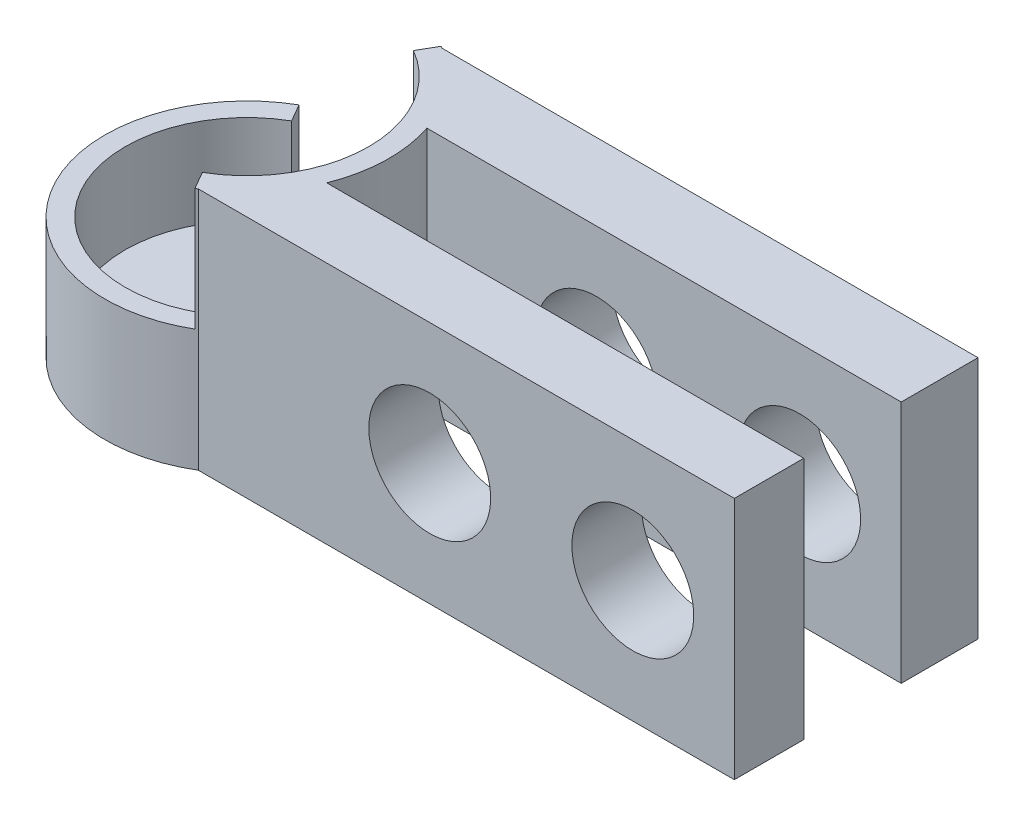
from build123d import *

# Parameters (mm, degrees)
BOSS_EXTRUDE1_DEPTH     = 30
CUT_EXTRUDE1_START      = 4
CUT_EXTRUDE1_DEPTH      = 30
SKETCH3_R               = 2
CUT_EXTRUDE2_DEPTH      = 9.5
CUT_EXTRUDE3_START      = 15
CUT_EXTRUDE3_DEPTH      = 20
CUT_EXTRUDE4_DEPTH      = 20
CUT_EXTRUDE4_DEPTH_BACK = 20
SKETCH5_R               = 7.5


with BuildPart() as part:
    # Sketch1 → Boss-Extrude1 (new body)
    with BuildSketch(Plane(origin=(0, 0, 0), x_dir=(1, 0, 0), z_dir=(0, 1, 0))):
        with BuildLine():
            Line((9.013878189, 15), (75, 15))
            Line((75, 15), (75, 5.549099401))
            Line((75, 5.549099401), (16.596912238, 5.549099401))
            ThreePointArc((16.596912238, 5.549099401), (17.493415402, -0.480018296), (16.26763294, -6.450900599))
            Line((16.26763294, -6.450900599), (75, -6.450900599))
            Line((75, -6.450900599), (75, -15))
            Line((75, -15), (9.013878189, -15))
            ThreePointArc((9.013878189, -15), (-17.5, 0), (9.013878189, 15))
        make_face()
    extrude(amount=BOSS_EXTRUDE1_DEPTH)

    # Sketch2 → Cut-Extrude1 (cut)
    with BuildSketch(Plane(origin=(0, 0, 0), x_dir=(1, 0, 0), z_dir=(0, 1, 0)).offset(CUT_EXTRUDE1_START)):
        with BuildLine():
            Line((8.75, 15.155444566), (7.5, 12.990381057))
            ThreePointArc((7.5, 12.990381057), (0, -15), (-7.5, 12.990381057))
            Line((-7.5, 12.990381057), (-8.75, 15.155444566))
            ThreePointArc((-8.75, 15.155444566), (-4.529333289, 16.90370196), (0, 17.5))
            ThreePointArc((0, 17.5), (4.529333289, 16.90370196), (8.75, 15.155444566))
        make_face()
    extrude(amount=CUT_EXTRUDE1_DEPTH, mode=Mode.SUBTRACT)

    # Sketch3 → Cut-Extrude2 (cut)
    with BuildSketch(Plane(origin=(0, 0, 0), x_dir=(1, 0, 0), z_dir=(0, 1, 0))):
        with Locations(Location((6.717514421, 6.717514421, 0), (0, 0, 270))):
            Circle(SKETCH3_R)
        with Locations(Location((6.717514421, -6.717514421, 0), (0, 0, 270))):
            Circle(SKETCH3_R)
        with Locations(Location((-6.717514421, -6.717514421, 0), (0, 0, 270))):
            Circle(SKETCH3_R)
        with Locations(Location((-6.717514421, 6.717514421, 0), (0, 0, 270))):
            Circle(SKETCH3_R)
    extrude(amount=CUT_EXTRUDE2_DEPTH, mode=Mode.SUBTRACT)

    # Sketch4 → Cut-Extrude3 (cut)
    with BuildSketch(Plane(origin=(0, 0, 0), x_dir=(1, 0, 0), z_dir=(0, 1, 0)).offset(CUT_EXTRUDE3_START)):
        with BuildLine():
            Line((8.75, -15.155444566), (0, 0))
            Line((0, 0), (8.75, 15.155444566))
            ThreePointArc((8.75, 15.155444566), (-17.5, 0), (8.75, -15.155444566))
        make_face()
    extrude(amount=CUT_EXTRUDE3_DEPTH, mode=Mode.SUBTRACT)

    # Sketch5 → Cut-Extrude4 (cut, two sides: drawn at the far end of the back side and taken through both)
    with BuildSketch(Plane.XY.offset(-CUT_EXTRUDE4_DEPTH_BACK)):
        with Locations(Location((62.5, 15, 0), (0, 0, 180))):
            Circle(SKETCH5_R)
        with Locations(Location((37.5, 15, 0), (0, 0, 180))):
            Circle(SKETCH5_R)
    extrude(amount=CUT_EXTRUDE4_DEPTH + CUT_EXTRUDE4_DEPTH_BACK, mode=Mode.SUBTRACT)


solid = part.part
